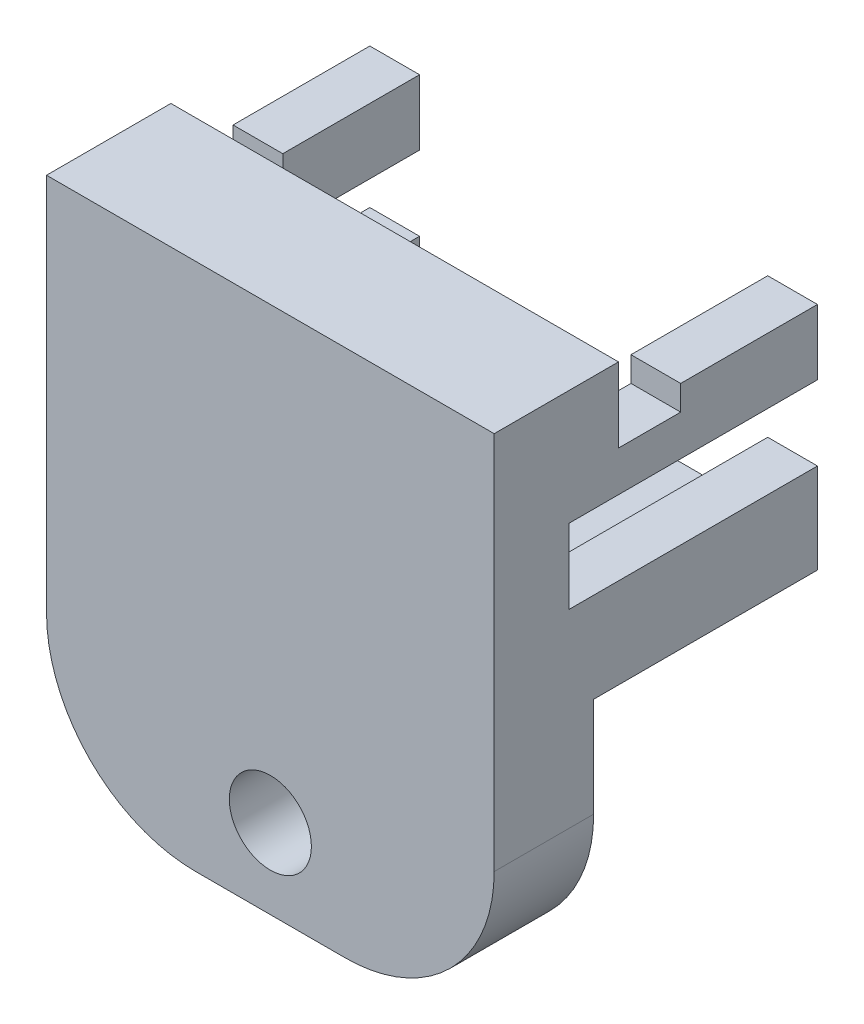
from build123d import *
from build123d.topology import SkipClean

# Parameters (mm, degrees)
ESBO_O1_R                = 1.65
RESSALTO_EXTRUS_O1_DEPTH = 3
RESSALTO_EXTRUS_O2_START = 15
ESBO_O2_R                = 1.65
RESSALTO_EXTRUS_O2_DEPTH = 15
CORTE_EXTRUS_O1_DEPTH    = 15
RESSALTO_EXTRUS_O3_DEPTH = 2
ESBO_O6_W                = 23.468316857
ESBO_O6_H                = 21.298976644
CORTE_EXTRUS_O2_DEPTH    = 21
ESBO_O7_W                = 18
ESBO_O7_H                = 18
RESSALTO_EXTRUS_O4_DEPTH = 2
CORTE_EXTRUS_O3_DEPTH    = 5
ESBO_O9_W                = 18
ESBO_O9_H                = 2
CORTE_EXTRUS_O4_DEPTH    = 8
ESBO_O10_W               = 18
ESBO_O10_H               = 4
RESSALTO_EXTRUS_O5_DEPTH = 7.5
ESBO_O11_R               = 1.65
CORTE_EXTRUS_O5_DEPTH    = 7.5
ESBO_O12_W               = 18
ESBO_O12_H               = 4
RESSALTO_EXTRUS_O6_DEPTH = 1.5
FILETE1_R                = 6
ESBO_O13_W               = 18
ESBO_O13_H               = 2.5
CORTE_EXTRUS_O6_DEPTH    = 1
ESBO_O14_W               = 18
ESBO_O14_H               = 9
CORTE_EXTRUS_O7_DEPTH    = 1


with BuildPart() as part:
    # Esboço1 → Ressalto-extrusão1 (new body)
    # profile 1 of 3: a face of its own
    with BuildSketch(Plane.XY):
        Polygon((-7, 15.25), (-9, 15.25), (-9, 13.25), (-9, 5), (-6.541451884, 0), (-2.020725942, -6), (2.020725942, -6), (6.541451884, 0), (9, 5), (9, 15.25), (7, 15.25), align=None)
        Polygon((2.020725942, -3.5), (4.041451884, 0), (2.020725942, 3.5), (-2.020725942, 3.5), (-4.041451884, 0), (-2.020725942, -3.5), align=None, mode=Mode.SUBTRACT)
        Polygon((-7, 13.25), (-7, 5), (0, 5), (7, 5), (7, 13.25), align=None, mode=Mode.SUBTRACT)
    # profile 2 of 3: a face of its own
    with BuildSketch(Plane.XY):
        Polygon((7, 13.25), (-7, 13.25), (-7, 5), (0, 5), (7, 5), align=None)
    # profile 3 of 3: a face of its own
    with BuildSketch(Plane.XY):
        Polygon((-2.020725942, -3.5), (2.020725942, -3.5), (4.041451884, 0), (2.020725942, 3.5), (-2.020725942, 3.5), (-4.041451884, 0), align=None)
        Circle(ESBO_O1_R, mode=Mode.SUBTRACT)
    extrude(amount=RESSALTO_EXTRUS_O1_DEPTH)

    # Esboço2 → Ressalto-extrusão2 (add)
    # profile 1 of 2: a face of its own
    with SkipClean():  # the faces are left unmerged after this step: merging them gives an invalid solid
        with BuildSketch(Plane(origin=(0, 0, 0), x_dir=(-1, 0, 0), z_dir=(0, 0, -1)).offset(RESSALTO_EXTRUS_O2_START)):
            Polygon((9, 5), (9, 15.25), (-9, 15.25), (-9, 5), (-6.541451884, 0), (-2.020725942, -6), (2.020725942, -6), (6.541451884, 0), align=None)
            Polygon((7, 5), (7, 13.25), (-7, 13.25), (-7, 5), (0, 5), align=None, mode=Mode.SUBTRACT)
            Polygon((-4.041451884, 0), (-2.020725942, -3.5), (2.020725942, -3.5), (4.041451884, 0), (2.020725942, 3.5), (-2.020725942, 3.5), align=None, mode=Mode.SUBTRACT)
        # profile 2 of 2: a face of its own
        with BuildSketch(Plane(origin=(0, 0, 0), x_dir=(-1, 0, 0), z_dir=(0, 0, -1)).offset(RESSALTO_EXTRUS_O2_START)):
            Polygon((-2.020725942, 3.5), (-4.041451884, 0), (-2.020725942, -3.5), (2.020725942, -3.5), (4.041451884, 0), (2.020725942, 3.5), align=None)
            Circle(ESBO_O2_R, mode=Mode.SUBTRACT)
        extrude(amount=-RESSALTO_EXTRUS_O2_DEPTH)

    # Esboço3 → Corte-extrusão1 (cut)
    with SkipClean():  # the faces are left unmerged after this step: merging them gives an invalid solid
        with BuildSketch(Plane(origin=(0, 0, -15), x_dir=(-1, 0, 0), z_dir=(0, 0, -1))):
            Polygon((-9, 10.625), (-9, 9.125), (-9, 7.625), (-7, 7.625), (-7, 10.625), align=None)
            Polygon((9, 7.625), (9, 9.125), (9, 10.625), (7, 10.625), (7, 7.625), align=None)
        extrude(amount=-CORTE_EXTRUS_O1_DEPTH, mode=Mode.SUBTRACT)

    # Esboço5 → Ressalto-extrusão3 (add)
    with SkipClean():  # the faces are left unmerged after this step: merging them gives an invalid solid
        with BuildSketch(Plane(origin=(0, 0, 0), x_dir=(-1, 0, 0), z_dir=(0, 0, -1))):
            Polygon((-1.583333333, 13.25), (-2.333333333, 13.25), (-3.083333333, 13.25), (-3.083333333, 5), (-1.583333333, 5), align=None)
        extrude(amount=RESSALTO_EXTRUS_O3_DEPTH)

    # Esboço6 → Corte-extrusão2 (cut)
    with BuildSketch(Plane(origin=(0, -16, 0), x_dir=(-1, 0, 0), z_dir=(0, -1, 0))):
        with Locations((-0.042259875, 5.70418088)):
            Rectangle(ESBO_O6_W, ESBO_O6_H)
    extrude(amount=-CORTE_EXTRUS_O2_DEPTH, mode=Mode.SUBTRACT)

    # Esboço7 → Ressalto-extrusão4 (add)
    with BuildSketch(Plane.XZ.offset(-5)):
        with Locations((0, -6)):
            Rectangle(ESBO_O7_W, ESBO_O7_H)
    extrude(amount=RESSALTO_EXTRUS_O4_DEPTH)

    # Esboço8 → Corte-extrusão3 (cut)
    with BuildSketch(Plane(origin=(0, 0, -15), x_dir=(-1, 0, 0), z_dir=(0, 0, -1))):
        Polygon((7, 7.625), (7, 5), (-7, 5), (-7, 7.625), (-9, 7.625), (-9, 3), (9, 3), (9, 7.625), align=None)
        Polygon((7, 10.625), (9, 10.625), (9, 15.25), (-9, 15.25), (-9, 10.625), (-7, 10.625), (-7, 13.25), (7, 13.25), align=None)
    extrude(amount=-CORTE_EXTRUS_O3_DEPTH, mode=Mode.SUBTRACT)

    # Esboço9 → Corte-extrusão4 (cut)
    with BuildSketch(Plane(origin=(0, 0, -10), x_dir=(-1, 0, 0), z_dir=(0, 0, -1))):
        with Locations((0, 14.25)):
            Rectangle(ESBO_O9_W, ESBO_O9_H)
    extrude(amount=-CORTE_EXTRUS_O4_DEPTH, mode=Mode.SUBTRACT)

    # Esboço10 → Ressalto-extrusão5 (add)
    with BuildSketch(Plane.XZ.offset(-3)):
        with Locations((0, 1)):
            Rectangle(ESBO_O10_W, ESBO_O10_H)
    extrude(amount=RESSALTO_EXTRUS_O5_DEPTH)

    # Esboço11 → Corte-extrusão5 (cut)
    with BuildSketch(Plane(origin=(0, 0, -1), x_dir=(-1, 0, 0), z_dir=(0, 0, -1))):
        with Locations((0, -2.8)):
            Circle(ESBO_O11_R)
    extrude(amount=-CORTE_EXTRUS_O5_DEPTH, mode=Mode.SUBTRACT)

    # Esboço12 → Ressalto-extrusão6 (add)
    with BuildSketch(Plane.XZ.offset(4.5)):
        with Locations((0, 1)):
            Rectangle(ESBO_O12_W, ESBO_O12_H)
    extrude(amount=RESSALTO_EXTRUS_O6_DEPTH)

    # Filete1
    filete1_edges = [part.edges().sort_by_distance(p)[0] for p in [
        (-9, -6, 1),
        (9, -6, 1),
    ]]
    fillet(filete1_edges, radius=FILETE1_R)

    # Esboço13 → Corte-extrusão6 (cut)
    with BuildSketch(Plane(origin=(0, 13.25, 0), x_dir=(1, 0, 0), z_dir=(0, 1, 0))):
        with Locations((0, 3.25)):
            Rectangle(ESBO_O13_W, ESBO_O13_H)
    extrude(amount=-CORTE_EXTRUS_O6_DEPTH, mode=Mode.SUBTRACT)

    # Esboço14 → Corte-extrusão7 (cut)
    with BuildSketch(Plane.XZ.offset(-3)):
        with Locations((0, -5.5)):
            Rectangle(ESBO_O14_W, ESBO_O14_H)
    extrude(amount=-CORTE_EXTRUS_O7_DEPTH, mode=Mode.SUBTRACT)


solid = part.part
